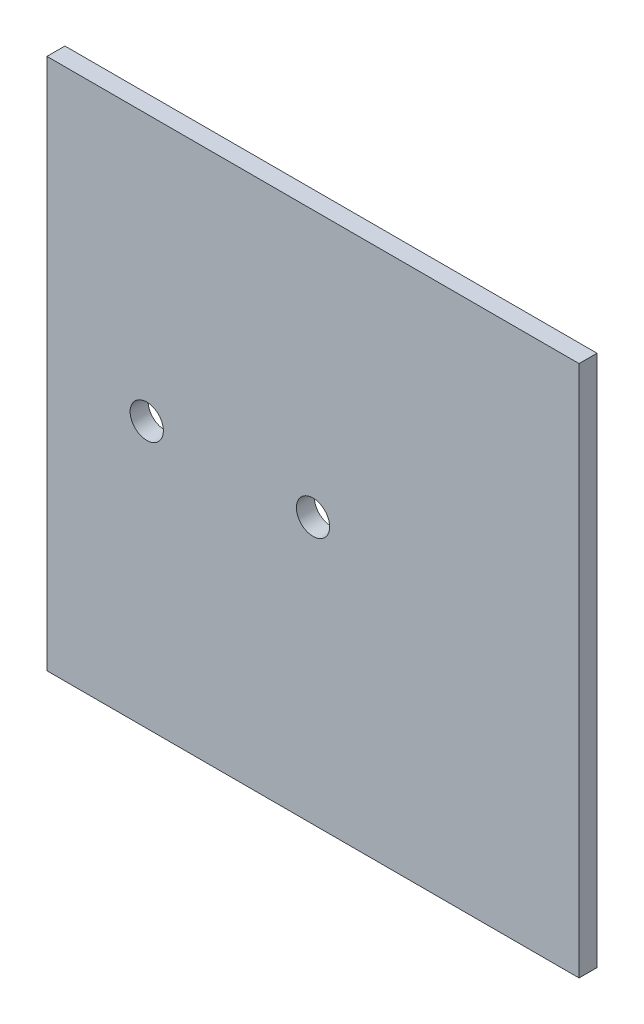
from build123d import *

# Parameters (mm, degrees)
CROQUIS1_W              = 80
CROQUIS1_H              = 80
SALIENTE_EXTRUIR2_DEPTH = 2.7
CROQUIS2_R              = 2.5
CORTAR_EXTRUIR1_DEPTH   = 2.7


with BuildPart() as part:
    # Croquis1 → Saliente-Extruir2 (new body)
    with BuildSketch(Plane.XY):
        with Locations((-42.7, 0)):
            Rectangle(CROQUIS1_W, CROQUIS1_H)
    extrude(amount=-SALIENTE_EXTRUIR2_DEPTH)

    # Croquis2 → Cortar-Extruir1 (cut)
    with BuildSketch(Plane(origin=(0, 0, -2.7), x_dir=(-1, 0, 0), z_dir=(0, 0, -1))):
        with Locations((67.7, 0)):
            Circle(CROQUIS2_R)
        with Locations((42.7, 0)):
            Circle(CROQUIS2_R)
    extrude(amount=-CORTAR_EXTRUIR1_DEPTH, mode=Mode.SUBTRACT)


solid = part.part
